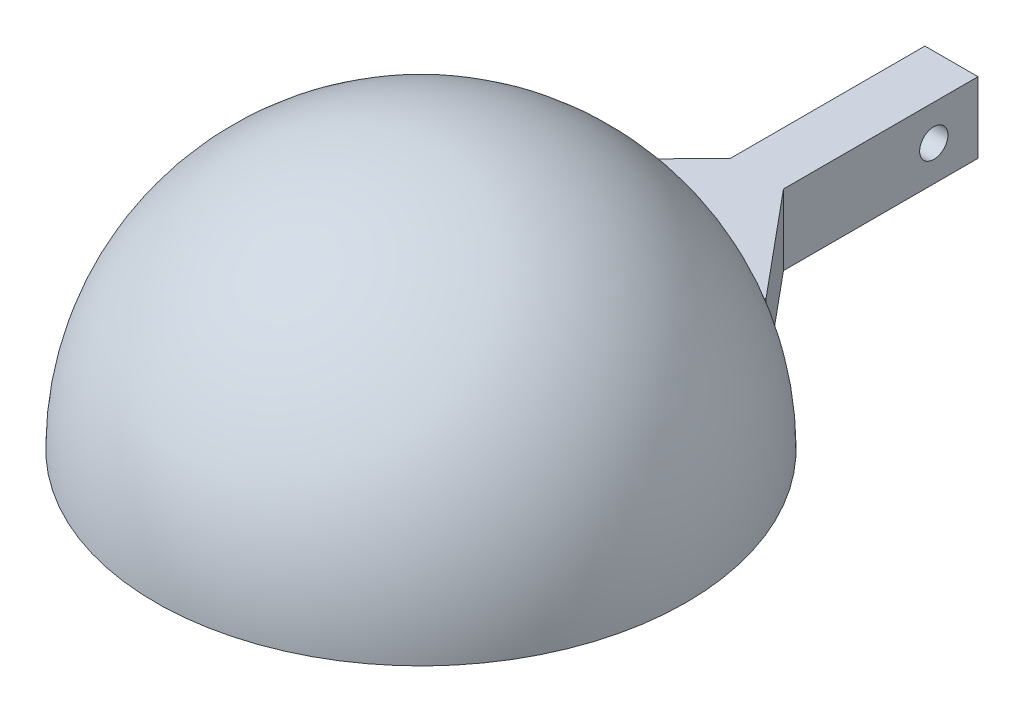
from build123d import *

# Parameters (mm, degrees)
SKETCH3_W           = 6
SKETCH3_H           = 30
BOSS_EXTRUDE1_DEPTH = 8
SKETCH4_R           = 1.6
CUT_EXTRUDE1_DEPTH  = 75.759614766


with BuildPart() as part:
    # Sketch2 → Revolve1 (revolve)
    with BuildSketch(Plane.XY):
        with BuildLine():
            Line((0, 28), (0, 30))
            ThreePointArc((0, 30), (21.213203436, 21.213203436), (30, 0))
            Line((30, 0), (28, 0))
            ThreePointArc((28, 0), (19.798989873, 19.798989873), (0, 28))
        make_face()
    revolve(axis=Axis((0, 0, 0), (0, 1, 0)))


with BuildPart() as body_2:
    # Sketch3 → Boss-Extrude1 (new body)
    with BuildSketch(Plane.XZ):
        with Locations((0, -45)):
            Rectangle(SKETCH3_W, SKETCH3_H)
        with BuildLine():
            Line((-3, -38), (3, -38))
            Line((3, -38), (12.72277757, -26.308006594))
            Line((12.72277757, -26.308006594), (12.190346348, -25.20705171))
            ThreePointArc((12.190346348, -25.20705171), (-0.71257008, -27.990931458), (-13.45712577, -24.554139488))
            Line((-13.45712577, -24.554139488), (-14.41834904, -26.308006594))
            Line((-14.41834904, -26.308006594), (-3, -38))
        make_face()
    extrude(amount=-BOSS_EXTRUDE1_DEPTH)

    # Sketch4 → Cut-Extrude1 (cut, through all)
    with BuildSketch(Plane(origin=(3, 0, 0), x_dir=(0, 0, -1), z_dir=(1, 0, 0))):
        with Locations((55, 4)):
            Circle(SKETCH4_R)
    extrude(amount=-CUT_EXTRUDE1_DEPTH, mode=Mode.SUBTRACT)


solid = Compound([part.part, body_2.part])
